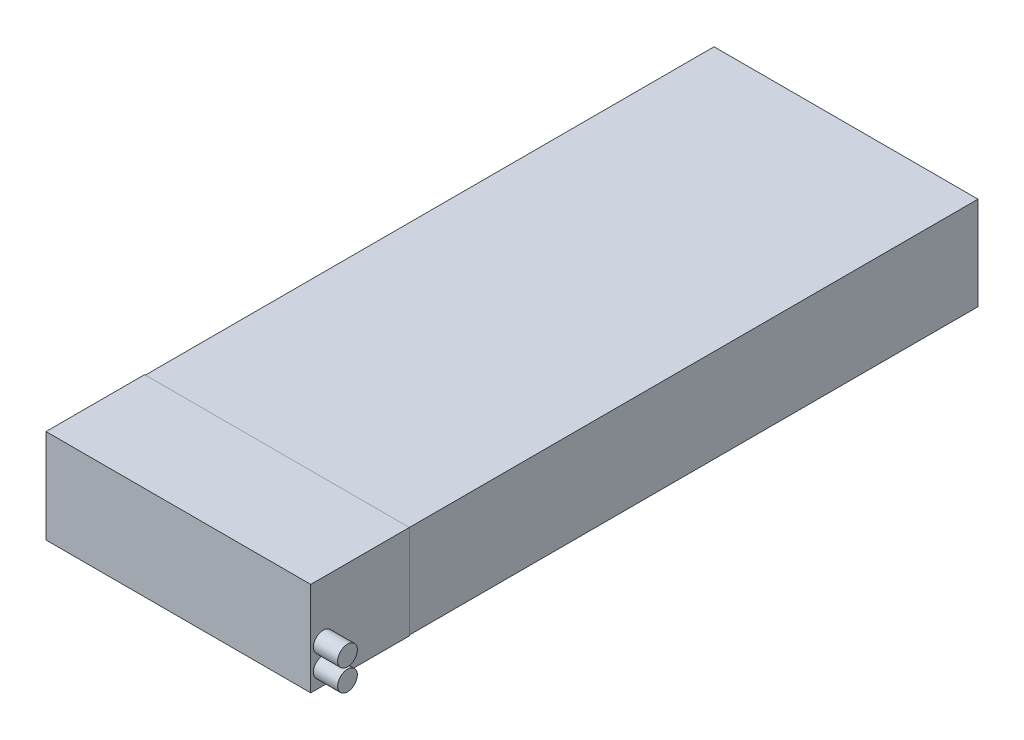
from build123d import *

# Parameters (mm, degrees)
SKETCH1_W           = 17
SKETCH1_H           = 6
BOSS_EXTRUDE1_DEPTH = 43
SKETCH3_W           = 17.0508
SKETCH3_H           = 6.0508
BOSS_EXTRUDE2_DEPTH = 6.35
SKETCH4_R           = 0.635
BOSS_EXTRUDE4_DEPTH = 1.5875


with BuildPart() as part:
    # Sketch1 → Boss-Extrude1 (new body)
    with BuildSketch(Plane.XY):
        with Locations((8.5, 3)):
            Rectangle(SKETCH1_W, SKETCH1_H)
    extrude(amount=BOSS_EXTRUDE1_DEPTH)

    # Sketch3 → Boss-Extrude2 (add)
    with BuildSketch(Plane.XY.offset(43)):
        with Locations((8.5, 3)):
            Rectangle(SKETCH3_W, SKETCH3_H)
    extrude(amount=-BOSS_EXTRUDE2_DEPTH)

    # Sketch4 → Boss-Extrude4 (add)
    with BuildSketch(Plane(origin=(17, 0, 0), x_dir=(0, 0, -1), z_dir=(1, 0, 0))):
        with Locations(Location((-42.193767819, 1.041160234, 0), (0, 0, 90))):
            Circle(SKETCH4_R)
        with Locations(Location((-42.193767819, 2.438160234, 0), (0, 0, 90))):
            Circle(SKETCH4_R)
    extrude(amount=BOSS_EXTRUDE4_DEPTH)


solid = part.part
